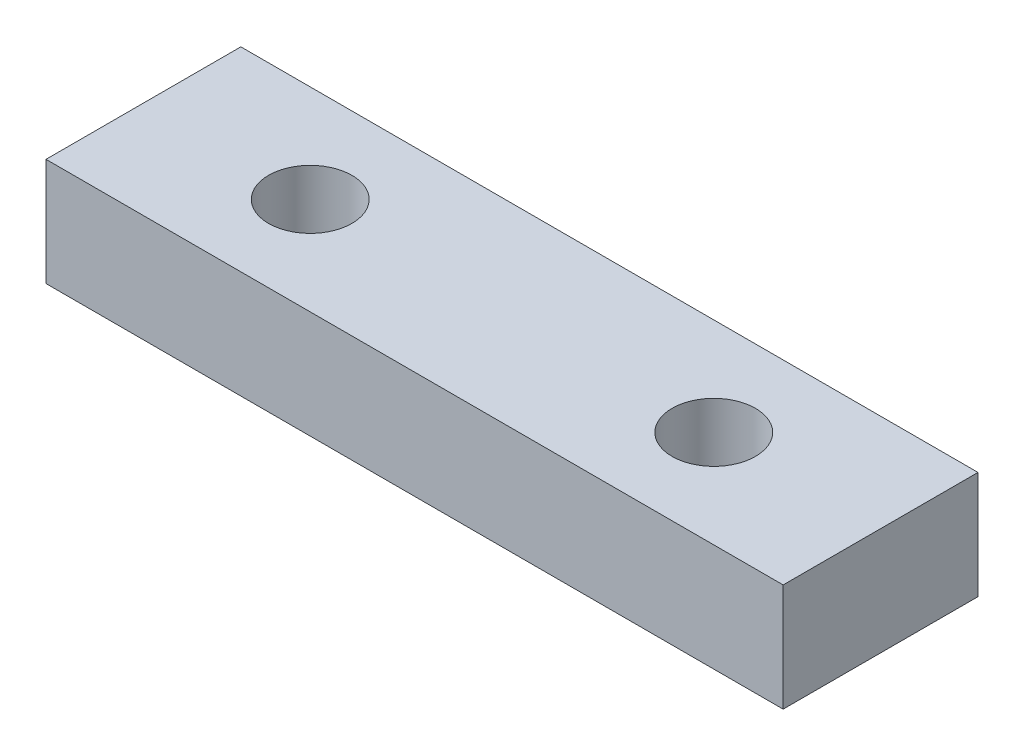
from build123d import *

# Parameters (mm, degrees)
SKETCH1_W           = 27.4
SKETCH1_H           = 7.242505129
SKETCH1_R           = 1.55
BOSS_EXTRUDE1_DEPTH = 4


with BuildPart() as part:
    # Sketch1 → Boss-Extrude1 (new body)
    with BuildSketch(Plane(origin=(0, 0, 0), x_dir=(1, 0, 0), z_dir=(0, 1, 0))):
        with Locations((0, -3.621252565)):
            Rectangle(SKETCH1_W, SKETCH1_H)
        with Locations(Location((7.5, -3.621252564, 0), (0, 0, 270))):
            Circle(SKETCH1_R, mode=Mode.SUBTRACT)
        with Locations(Location((-7.5, -3.621252564, 0), (0, 0, 270))):
            Circle(SKETCH1_R, mode=Mode.SUBTRACT)
    extrude(amount=BOSS_EXTRUDE1_DEPTH)


solid = part.part
